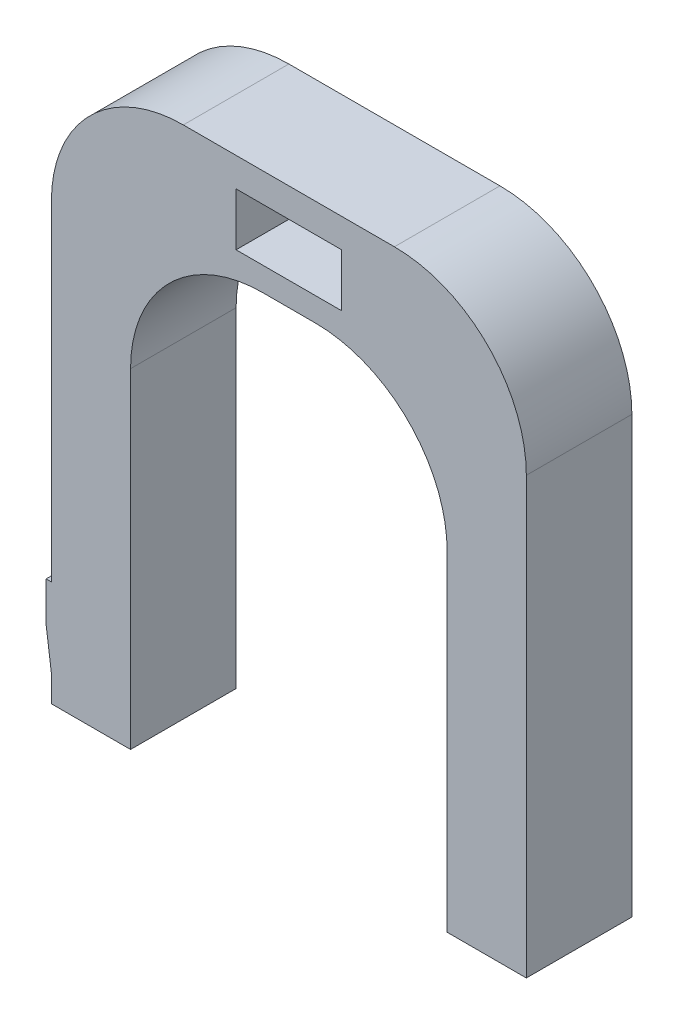
from build123d import *

# Parameters (mm, degrees)
SKETCH_2_W          = 18
SKETCH_2_H          = 21.5
EXTRUDE_1_DEPTH     = 4
SKETCH_3_W          = 12
SKETCH_3_H          = 17.5
CUT_EXTRUDE_1_DEPTH = 29.324018077
FILLET_1_R          = 5
FILLET_2_R          = 5
SKETCH_4_W          = 4
SKETCH_4_H          = 2
CUT_EXTRUDE_2_DEPTH = 29.324018077
SKETCH_5_W          = 4
SKETCH_5_H          = 3
EXTRUDE_2_DEPTH     = 0.2
CUT_EXTRUDE_3_DEPTH = 29.324018077


with BuildPart() as part:
    # ｽｹｯﾁ2 → ﾎﾞｽ - 押し出し1 (new body)
    with BuildSketch(Plane.XY):
        with Locations((9, 10.75)):
            Rectangle(SKETCH_2_W, SKETCH_2_H)
    extrude(amount=EXTRUDE_1_DEPTH)

    # ｽｹｯﾁ3 → ｶｯﾄ - 押し出し1 (cut, through all)
    with BuildSketch(Plane.XY.offset(4)):
        with Locations((9, 8.75)):
            Rectangle(SKETCH_3_W, SKETCH_3_H)
    extrude(amount=-CUT_EXTRUDE_1_DEPTH, mode=Mode.SUBTRACT)

    # ﾌｨﾚｯﾄ1
    fillet_1_edges = [part.edges().sort_by_distance(p)[0] for p in [
        (3, 17.5, 2),
        (15, 17.5, 2),
    ]]
    fillet(fillet_1_edges, radius=FILLET_1_R)

    # ﾌｨﾚｯﾄ2
    fillet_2_edges = [part.edges().sort_by_distance(p)[0] for p in [
        (0, 21.5, 2),
        (18, 21.5, 2),
    ]]
    fillet(fillet_2_edges, radius=FILLET_2_R)

    # ｽｹｯﾁ4 → ｶｯﾄ - 押し出し2 (cut, through all)
    with BuildSketch(Plane.XY.offset(4)):
        with Locations((9, 19.400947982)):
            Rectangle(SKETCH_4_W, SKETCH_4_H)
    extrude(amount=-CUT_EXTRUDE_2_DEPTH, mode=Mode.SUBTRACT)

    # ｽｹｯﾁ5 → ﾎﾞｽ - 押し出し2 (add)
    with BuildSketch(Plane.ZY):
        with Locations((2, 2.5)):
            Rectangle(SKETCH_5_W, SKETCH_5_H)
    extrude(amount=EXTRUDE_2_DEPTH)

    # ｽｹｯﾁ6 → ｶｯﾄ - 押し出し3 (cut, through all)
    with BuildSketch(Plane.XY.offset(4)):
        Polygon((0, 1), (-0.2, 2.5), (-0.2, 1), align=None)
    extrude(amount=-CUT_EXTRUDE_3_DEPTH, mode=Mode.SUBTRACT)


solid = part.part
